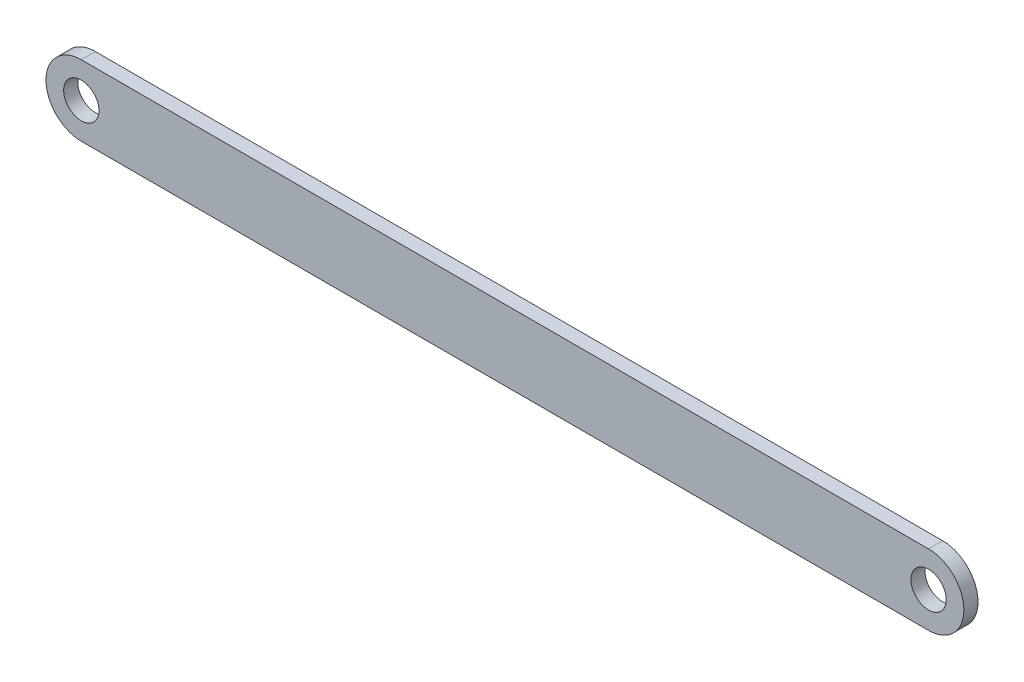
from build123d import *

# Parameters (mm, degrees)
SKETCH1_R           = 3.175
BOSS_EXTRUDE1_DEPTH = 2.54


with BuildPart() as part:
    # Sketch1 → Boss-Extrude1 (new body)
    with BuildSketch(Plane.XY):
        with BuildLine():
            Line((116.242136937, 8.756721034), (-36.157863063, 8.756721034))
            ThreePointArc((-36.157863063, 8.756721034), (-42.507863063, 2.406721034), (-36.157863063, -3.943278966))
            Line((-36.157863063, -3.943278966), (116.242136937, -3.943278966))
            ThreePointArc((116.242136937, -3.943278966), (122.592136937, 2.406721034), (116.242136937, 8.756721034))
        make_face()
        with Locations((-36.157863063, 2.406721034)):
            Circle(SKETCH1_R, mode=Mode.SUBTRACT)
        with Locations((116.242136937, 2.406721034)):
            Circle(SKETCH1_R, mode=Mode.SUBTRACT)
    extrude(amount=-BOSS_EXTRUDE1_DEPTH)


solid = part.part
